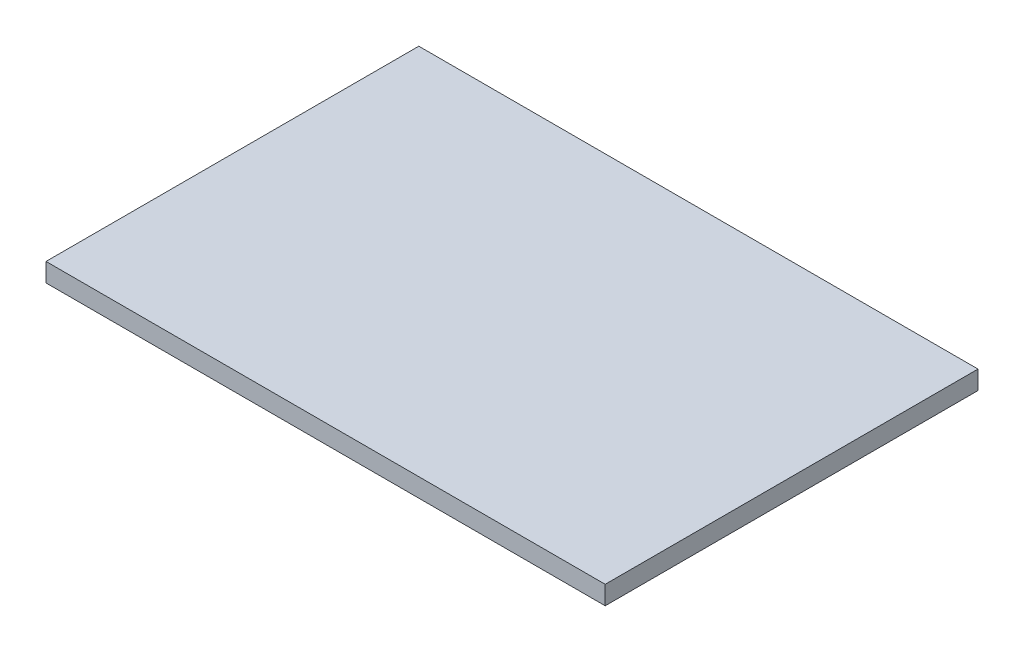
from build123d import *

# Parameters (mm, degrees)
CROQUIS1_W              = 300
CROQUIS1_H              = 200
SALIENTE_EXTRUIR1_DEPTH = 10


with BuildPart() as part:
    # Croquis1 → Saliente-Extruir1 (new body)
    with BuildSketch(Plane(origin=(0, 0, 0), x_dir=(1, 0, 0), z_dir=(0, 1, 0))):
        Rectangle(CROQUIS1_W, CROQUIS1_H)
    extrude(amount=SALIENTE_EXTRUIR1_DEPTH)


solid = part.part
